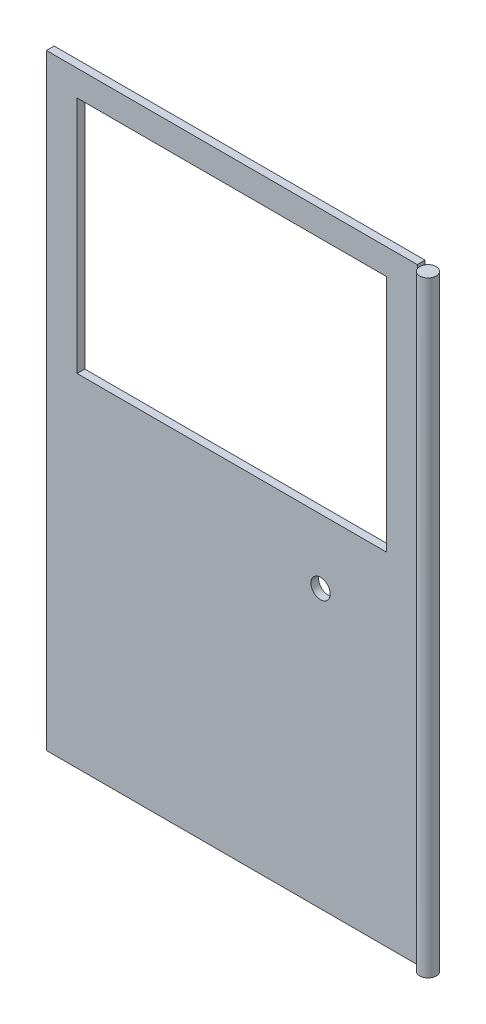
from build123d import *

# Parameters (mm, degrees)
SKETCH1_W                       = 575
SKETCH1_H                       = 940
SKETCH1_W_2                     = 480
SKETCH1_H_2                     = 370
BOSS_EXTRUDE1_DEPTH             = 12
BOSS_EXTRUDE2_REACH             = 553.09
SKETCH2_R                       = 12.7
BOSS_EXTRUDE2_DIRECTION_2_REACH = 553.09
SKETCH3_R                       = 12.5
SKETCH3_R_2                     = 15
CUT_EXTRUDE1_DEPTH              = 568.759993307


with BuildPart() as part:
    # Sketch1 → Boss-Extrude1 (new body)
    with BuildSketch(Plane.XY):
        Rectangle(SKETCH1_W, SKETCH1_H)
        with Locations((0, 245)):
            Rectangle(SKETCH1_W_2, SKETCH1_H_2, mode=Mode.SUBTRACT)
    extrude(amount=BOSS_EXTRUDE1_DEPTH)


with BuildPart() as body_2:

    # Boss-Extrude2: up to this face of the body (flat: up to its plane)
    boss_extrude2_end = Plane(part.part.faces().sort_by_distance((0, 470, 6))[0])
    # Sketch2 → Boss-Extrude2 (new, up to the picked face)
    with BuildSketch(Plane(origin=(0, 0, 0), x_dir=(1, 0, 0), z_dir=(0, 1, 0)), mode=Mode.PRIVATE) as boss_extrude2_sk1:
        with Locations(Location((304.8, -12.7, 0), (0, 0, 90))):
            Circle(SKETCH2_R)
    boss_extrude2_tool1 = split(extrude(boss_extrude2_sk1.sketch, amount=BOSS_EXTRUDE2_REACH, mode=Mode.PRIVATE), bisect_by=boss_extrude2_end, keep=Keep.BOTH, mode=Mode.PRIVATE)
    add(boss_extrude2_tool1.solids().sort_by(Axis((304.8, 0, 12.7), (0, 1, 0)))[0])


    # Boss-Extrude2 direction 2: up to this face of the body (flat: up to its plane)
    boss_extrude2_direction_2_end = Plane(part.part.faces().sort_by_distance((0, -470, 6))[0])
    # Sketch2 → Boss-Extrude2 direction 2 (add, up to the picked face)
    with BuildSketch(Plane(origin=(0, 0, 0), x_dir=(1, 0, 0), z_dir=(0, 1, 0)), mode=Mode.PRIVATE) as boss_extrude2_direction_2_sk1:
        with Locations(Location((304.8, -12.7, 0), (0, 0, 90))):
            Circle(SKETCH2_R)
    boss_extrude2_direction_2_tool1 = split(extrude(boss_extrude2_direction_2_sk1.sketch, amount=-BOSS_EXTRUDE2_DIRECTION_2_REACH, mode=Mode.PRIVATE), bisect_by=boss_extrude2_direction_2_end, keep=Keep.BOTH, mode=Mode.PRIVATE)
    add(boss_extrude2_direction_2_tool1.solids().sort_by(Axis((304.8, 0, 12.7), (0, -1, 0)))[0])


with BuildPart() as part_1:
    add(part.part)

    # Sketch3 → Cut-Extrude1 (cut, through all)
    with BuildSketch(Plane(origin=(0, 0, 0), x_dir=(-1, 0, 0), z_dir=(0, 0, -1))):
        with Locations((-137.5, -40)):
            Circle(SKETCH3_R)
        with Locations((-137.5, -40)):
            Circle(SKETCH3_R_2)
    extrude(amount=-CUT_EXTRUDE1_DEPTH, mode=Mode.SUBTRACT)


solid = Compound([body_2.part, part_1.part])
